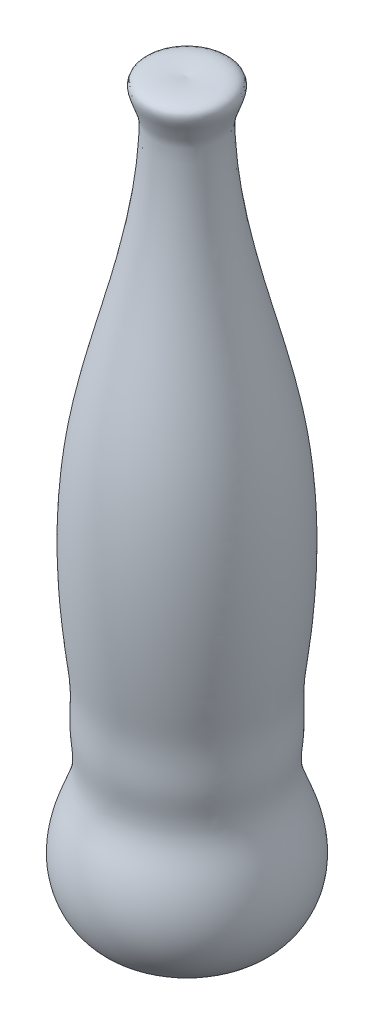
from build123d import *


with BuildPart() as part:
    # Croquis1 → Revolución2 (revolve)
    with BuildSketch(Plane.XY):
        with BuildLine():
            Line((0, -13.937032388), (0, 28.581673016))
            add(Edge.make_bspline(
                [(0, -13.937032388), (1.355456163, -13.982947468), (4.219148206, -14.076671303), (5.988301853, -10.703838667), (5.503636529, -8.05008433), (4.443271806, -5.853555608), (4.838388244, -3.801652431), (4.660633132, -1.873070716), (5.06939486, 1.037121785), (5.397336701, 5.325374088), (5.000664771, 11.74415375), (3.304111116, 17.276458337), (2.248079005, 22.285292593), (1.961659637, 24.791798679), (1.909585613, 27.603544335), (3.808416574, 29.089108234), (0, 28.581673016)],
                knots=[0, 0, 0, 0, 0.090812642, 0.144815471, 0.209981468, 0.251516804, 0.291137763, 0.334316046, 0.370754544, 0.471482761, 0.599534864, 0.764051266, 0.826503452, 0.915116877, 0.918715067, 1, 1, 1, 1], degree=3))
        make_face()
    revolve(axis=Axis((0, -13.937032388, 0), (0, 1, 0)))


solid = part.part
